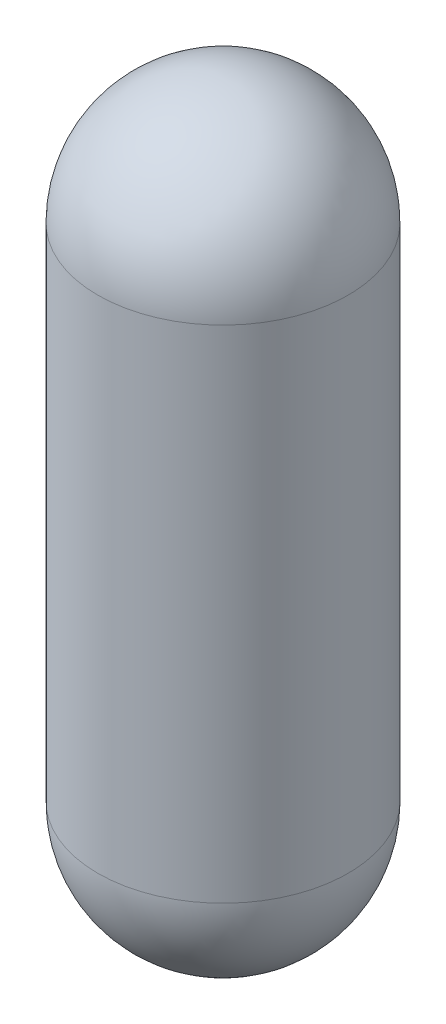
from build123d import *

# Parameters (mm, degrees)
SKETCH1_R           = 50.8
BOSS_EXTRUDE1_DEPTH = 101.6


with BuildPart() as part:
    # Sketch1 → Boss-Extrude1 (new, symmetric)
    with BuildSketch(Plane(origin=(0, 0, 0), x_dir=(1, 0, 0), z_dir=(0, 1, 0))):
        with Locations(Location((0, 0, 0), (0, 0, 270))):
            Circle(SKETCH1_R)
    extrude(amount=BOSS_EXTRUDE1_DEPTH, both=True)

    # Sketch3 → Revolve1 (revolve)
    with BuildSketch(Plane(origin=(0, 0, 0), x_dir=(0, 0, -1), z_dir=(1, 0, 0)), mode=Mode.PRIVATE) as revolve1_sk:
        with BuildLine():
            Line((0, 101.6), (-50.8, 101.6))
            ThreePointArc((-50.8, 101.6), (-35.921024484, 137.521024484), (0, 152.4))
            Line((0, 152.4), (0, 101.6))
        make_face()
    revolve1 = revolve(revolve1_sk.sketch.rotate(Axis((0, 152.4, 0), (0, -1, 0)), 180), axis=Axis((0, 152.4, 0), (0, -1, 0)))

    # Mirror1: Revolve1 across plane
    add(revolve1.mirror(Plane.ZX))


solid = part.part
